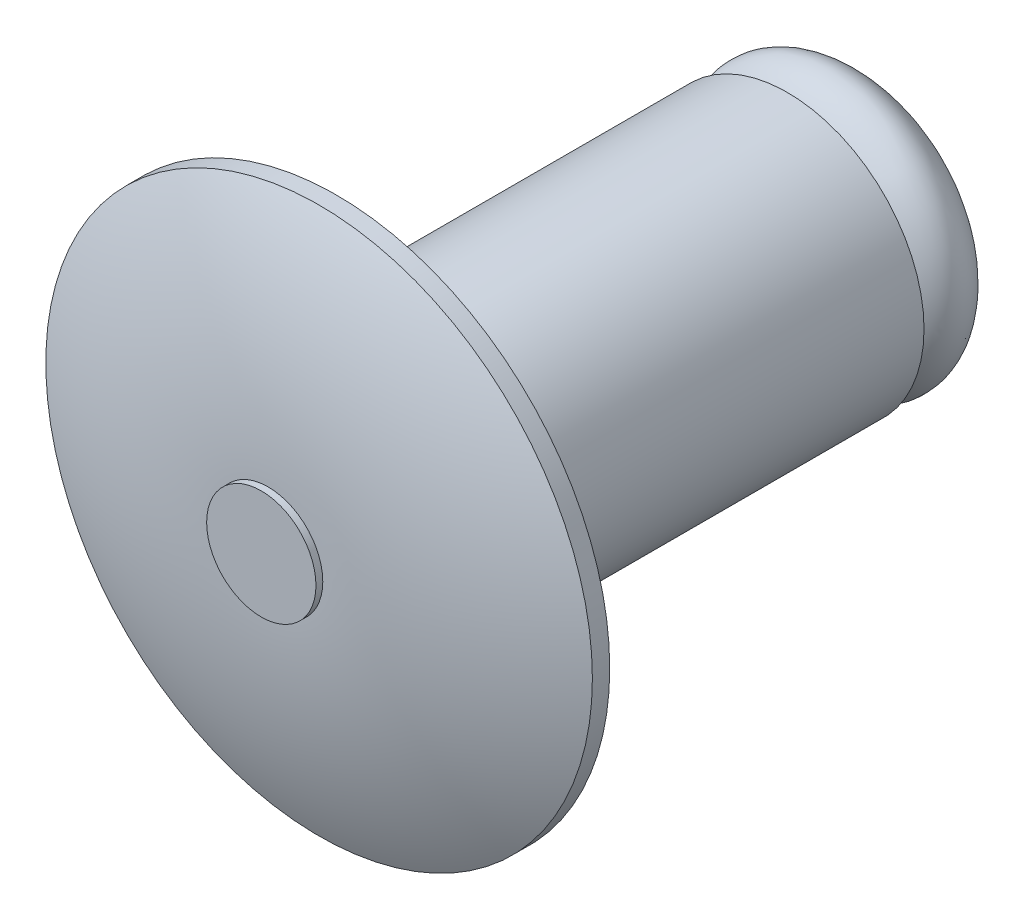
from build123d import *

# Parameters (mm, degrees)
CUT_EXTRUDE1_DEPTH      = 13.280472369
CUT_EXTRUDE1_DEPTH_BACK = 13.280472369
CUT_EXTRUDE2_DEPTH      = 13.280472369
CUT_EXTRUDE2_DEPTH_BACK = 13.280472369
FILLET2_R               = 0.254
SKETCH5_R               = 1.211430269
CUT_EXTRUDE3_DEPTH      = 10


with BuildPart() as part:
    # Sketch2 → Revolve1 (revolve)
    with BuildSketch(Plane(origin=(0, 0, 0), x_dir=(0, 0, -1), z_dir=(1, 0, 0)), mode=Mode.PRIVATE) as revolve1_sk:
        with BuildLine():
            Line((-10.9, 0), (-10.9, 0.8))
            Line((-10.9, 0.8), (-1, 0.8))
            ThreePointArc((-1, 0.8), (-0.811032662, 2.442902614), (-0.254, 4))
            Line((-0.254, 4), (0, 4))
            Line((0, 4), (0, 2))
            Line((0, 2), (6.6, 2))
            Line((6.6, 2), (6.6, 1.5))
            add(Edge.make_bspline(
                [(8.1, 0), (8.1, 4.430500874), (6.6, 1.5)],
                knots=[4.71238898, 4.71238898, 4.71238898, 7.005919555, 7.005919555, 7.005919555], degree=2, weights=[1, 0.411437828, 1]))
            Line((8.1, 0), (6.6, 0))
            Line((6.6, 0), (-10.9, 0))
        make_face()
    revolve(revolve1_sk.sketch.rotate(Axis((0, 0, 10.9), (0, 0, -1)), 90), axis=Axis((0, 0, 10.9), (0, 0, -1)))

    # Sketch3 → Cut-Extrude1 (cut, two sides: drawn at the far end of the back side and taken through both)
    with BuildSketch(Plane(origin=(0, 0, 0), x_dir=(1, 0, 0), z_dir=(0, 1, 0)).offset(-CUT_EXTRUDE1_DEPTH_BACK)):
        Polygon((0, -10.9), (1.0032, -9.592604306), (1.0032, -11.408), (-1.0032, -11.408), (-1.0032, -9.592604306), align=None)
    extrude(amount=CUT_EXTRUDE1_DEPTH + CUT_EXTRUDE1_DEPTH_BACK, mode=Mode.SUBTRACT)

    # Sketch4 → Cut-Extrude2 (cut, two sides: drawn at the far end of the back side and taken through both)
    with BuildSketch(Plane(origin=(0, 0, 0), x_dir=(0, 0, -1), z_dir=(1, 0, 0)).offset(-CUT_EXTRUDE2_DEPTH_BACK)):
        Polygon((-11.154, 0), (-9.846, 1.308), (-11.408, 1.308), (-11.408, -1.308), (-9.846, -1.308), align=None)
    extrude(amount=CUT_EXTRUDE2_DEPTH + CUT_EXTRUDE2_DEPTH_BACK, mode=Mode.SUBTRACT)

    # Fillet2
    fillet2_edges = [part.edges().sort_by_distance(p)[0] for p in [
        (-2, 0, 0),
    ]]
    fillet(fillet2_edges, radius=FILLET2_R)

    # Sketch5 → Cut-Extrude3 (cut)
    with BuildSketch(Plane(origin=(0, 0, 1.1), x_dir=(-1, 0, 0), z_dir=(0, 0, -1))):
        Circle(SKETCH5_R)
    extrude(amount=-CUT_EXTRUDE3_DEPTH, mode=Mode.SUBTRACT)


solid = part.part
